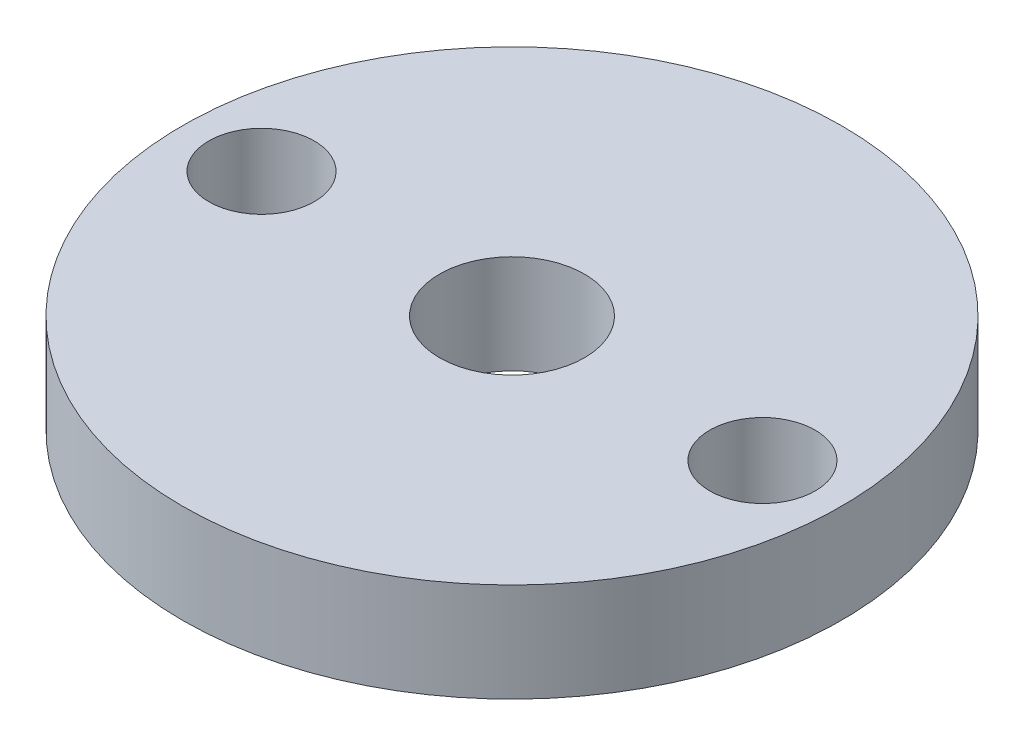
from build123d import *

# Parameters (mm, degrees)
SKETCH1_R           = 25
SKETCH1_R_2         = 1.8
SKETCH1_R_3         = 5.5
BOSS_EXTRUDE1_DEPTH = 7.5
SKETCH2_R           = 4
CUT_EXTRUDE1_DEPTH  = 6


with BuildPart() as part:
    # Sketch1 → Boss-Extrude1 (new body)
    with BuildSketch(Plane(origin=(0, 0, 0), x_dir=(1, 0, 0), z_dir=(0, 1, 0))):
        with Locations(Location((0, 0, 0), (0, 0, 270))):
            Circle(SKETCH1_R)
        with Locations(Location((-19, 0, 0), (0, 0, 270))):
            Circle(SKETCH1_R_2, mode=Mode.SUBTRACT)
        with Locations(Location((19, 0, 0), (0, 0, 90))):
            Circle(SKETCH1_R_2, mode=Mode.SUBTRACT)
        with Locations(Location((0, 0, 0), (0, 0, 270))):
            Circle(SKETCH1_R_3, mode=Mode.SUBTRACT)
    extrude(amount=BOSS_EXTRUDE1_DEPTH)

    # Sketch2 → Cut-Extrude1 (cut)
    with BuildSketch(Plane(origin=(0, 7.5, 0), x_dir=(1, 0, 0), z_dir=(0, 1, 0))):
        with Locations(Location((-19, 0, 0), (0, 0, 270))):
            Circle(SKETCH2_R)
        with Locations(Location((19, 0, 0), (0, 0, 270))):
            Circle(SKETCH2_R)
    extrude(amount=-CUT_EXTRUDE1_DEPTH, mode=Mode.SUBTRACT)


solid = part.part
